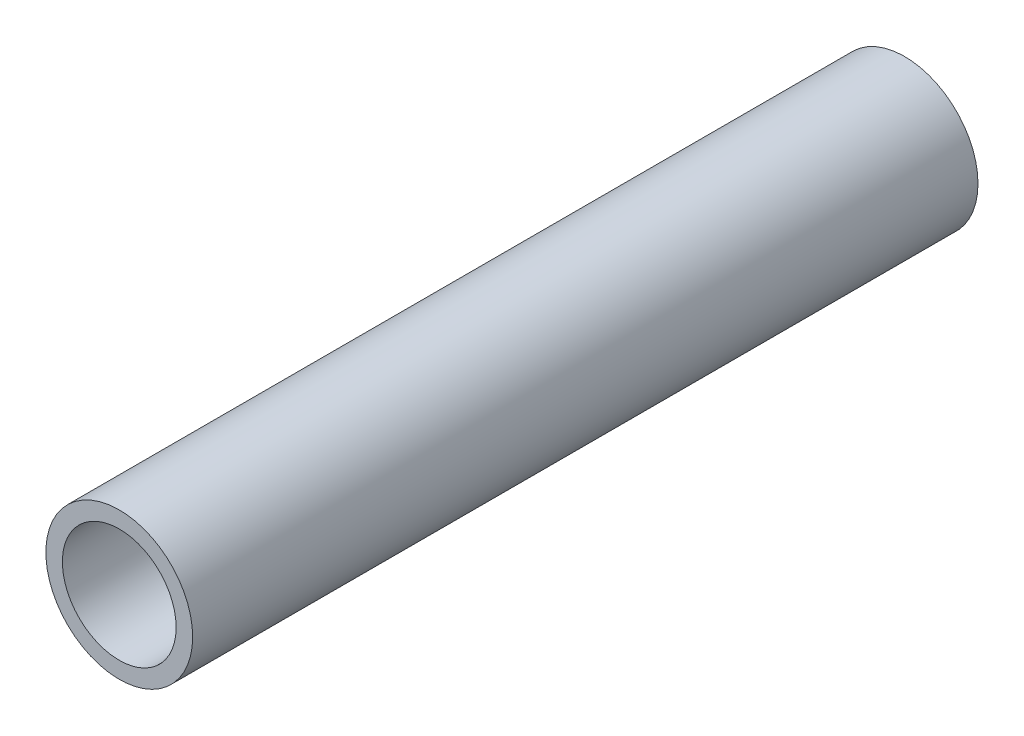
from build123d import *

# Parameters (mm, degrees)
SKETCH_1_R      = 1
SKETCH_1_R_2    = 0.775
EXTRUDE_1_DEPTH = 10.7


with BuildPart() as part:
    # Эскиз1 → Бобышка-Вытянуть1 (new body)
    with BuildSketch(Plane.XY):
        Circle(SKETCH_1_R)
        Circle(SKETCH_1_R_2, mode=Mode.SUBTRACT)
    extrude(amount=EXTRUDE_1_DEPTH)


solid = part.part
